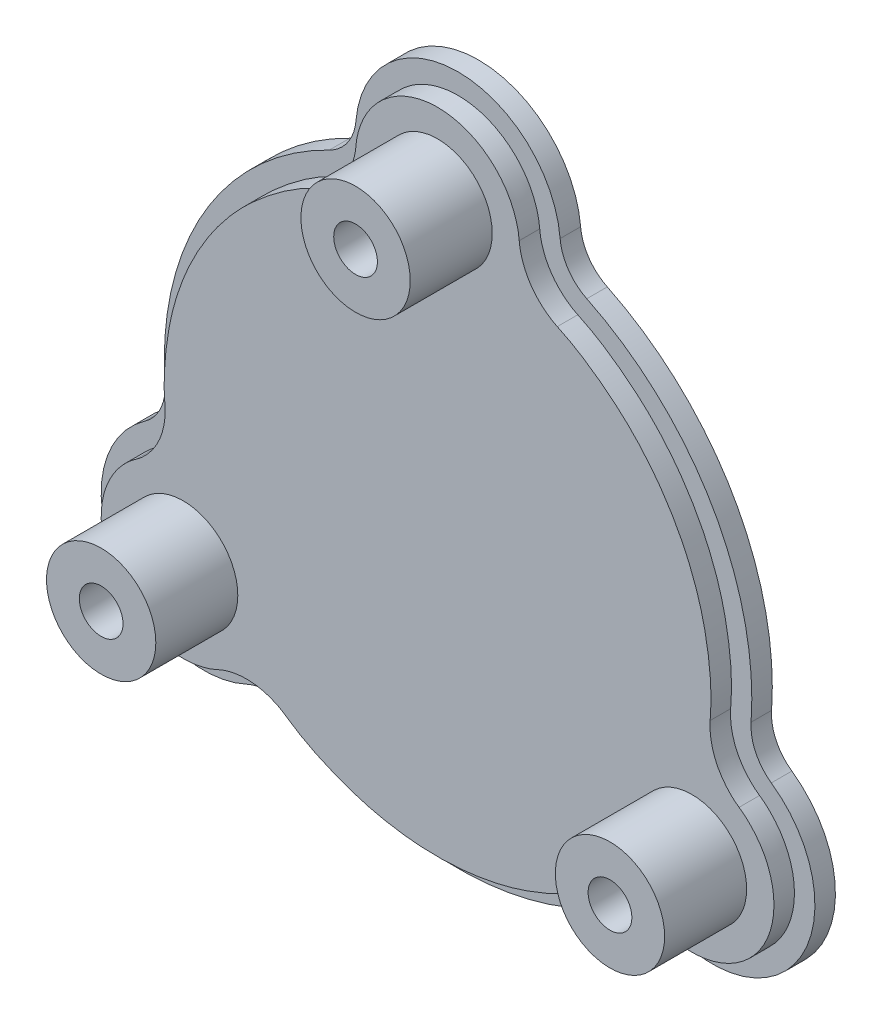
from build123d import *

# Parameters (mm, degrees)
BOSS_EXTRUDE1_DEPTH                     = 3
BOSS_EXTRUDE2_DEPTH                     = 3
SKETCH4_R                               = 8
BOSS_EXTRUDE3_DEPTH                     = 12
CBORE_FOR_M6_HEX_HEAD_BOLT2_D           = 6.4
CBORE_FOR_M6_HEX_HEAD_BOLT2_CBORE_D     = 14.55
CBORE_FOR_M6_HEX_HEAD_BOLT2_CBORE_DEPTH = 4.38


with BuildPart() as part:
    # Sketch1 → Boss-Extrude1 (new body)
    with BuildSketch(Plane.XY):
        with BuildLine():
            ThreePointArc((42.894958583, -3.003752345), (37.239092363, 21.5), (18.846153454, 38.65))
            ThreePointArc((18.846153454, 38.65), (16.147655157, 40.973517523), (14.941453584, 44.323995772))
            ThreePointArc((14.941453584, 44.323995772), (0, 58), (-14.941453584, 44.323995772))
            ThreePointArc((-14.941453584, 44.323995772), (-16.147655157, 40.973517523), (-18.846153454, 38.65))
            ThreePointArc((-18.846153454, 38.65), (-37.239092363, 21.5), (-42.894958583, -3.003752345))
            ThreePointArc((-42.894958583, -3.003752345), (-43.557934635, -6.502479184), (-45.856433127, -9.222319513))
            ThreePointArc((-45.856433127, -9.222319513), (-50.229473419, -29), (-30.914979544, -35.101676259))
            ThreePointArc((-30.914979544, -35.101676259), (-27.410279478, -34.471038339), (-24.048805129, -35.646247655))
            ThreePointArc((-24.048805129, -35.646247655), (0, -43), (24.048805129, -35.646247655))
            ThreePointArc((24.048805129, -35.646247655), (27.410279478, -34.471038339), (30.914979544, -35.101676259))
            ThreePointArc((30.914979544, -35.101676259), (50.229473419, -29), (45.856433127, -9.222319513))
            ThreePointArc((45.856433127, -9.222319513), (43.557934635, -6.502479184), (42.894958583, -3.003752345))
        make_face()
    extrude(amount=BOSS_EXTRUDE1_DEPTH)

    # 3DSketch1 → Boss-Extrude2 (add)
    with BuildSketch(Plane(origin=(17.52698283, 35.955596171, 3), x_dir=(-0.6916901144369885, -0.7221944236769943, 0), z_dir=(0, 0, 1))):
        with BuildLine():
            add(Edge.make_bspline(
                [(-5e-09, -2e-09), (0.035266361, -0.110043051), (0.070511726, -0.220092408), (0.104895107, -0.330400636), (0.203480375, -0.66470447), (0.278915236, -1.005960833), (0.320630187, -1.236304934), (0.40721379, -1.815458075), (0.459739267, -2.397249901), (0.477689586, -2.746840897), (0.483852206, -3.44618664), (0.425322622, -4.144123782), (0.38040418, -4.491793187), (0.260298804, -5.182639628), (0.081734048, -5.860713269), (-0.022258615, -6.195483331), (-0.255051995, -6.841022944), (-0.545064383, -7.461933899), (-0.699515738, -7.760205855), (-0.973198354, -8.243799634), (-1.27383881, -8.712312975), (-1.397769789, -8.893729969), (-1.588782564, -9.152885267), (-1.795468246, -9.399066163), (-1.862478067, -9.476728094), (-1.930013019, -9.553946514), (-1.997546942, -9.631165804), (-1.997678956, -9.63131675)],
                knots=[0, 0, 0, 0, 0, 0, 0.056254645, 0.056254645, 0.056254645, 0.16970042, 0.16970042, 0.16970042, 0.339869082, 0.339869082, 0.339869082, 0.510037744, 0.510037744, 0.510037744, 0.680206406, 0.680206406, 0.680206406, 0.843494618, 0.843494618, 0.843494618, 0.950059942, 0.950059942, 0.950059942, 0.999902378, 1, 1, 1, 1, 1, 1], degree=5))
            add(Edge.make_bspline(
                [(-1.997678956, -9.63131675), (-2.08959454, -9.736414413), (-2.181506582, -9.841515062), (-2.272592776, -9.947311862), (-2.541163817, -10.269178096), (-2.787458164, -10.609822544), (-2.943189419, -10.843616244), (-3.314575566, -11.440159763), (-3.649648712, -12.05581974), (-3.836008647, -12.432252484), (-4.176138071, -13.199501153), (-4.444641518, -13.996135515), (-4.560994108, -14.400468331), (-4.757915743, -15.218503654), (-4.88329973, -16.049955203), (-4.92791192, -16.468048122), (-4.980585913, -17.30699442), (-4.959377566, -18.147513988), (-4.930398613, -18.567074878), (-4.835882755, -19.402614449), (-4.668634216, -20.226620759), (-4.567080093, -20.63470489), (-4.328618776, -21.440963688), (-4.020464586, -22.223260728), (-3.849402412, -22.607436813), (-3.474184186, -23.359880124), (-3.03453076, -24.076577736), (-2.799195391, -24.425101105), (-2.298707632, -25.100718946), (-1.740986405, -25.729922945), (-1.448563927, -26.032149947), (-0.838088247, -26.610310881), (-0.179337131, -27.132799529), (0.161238539, -27.379496673), (0.86305261, -27.842538384), (1.602717154, -28.242358509), (1.981045035, -28.425992834), (2.752757991, -28.759769331), (3.550717298, -29.024680158), (3.955231721, -29.139632075), (4.773276467, -29.333954761), (5.60524574, -29.455966835), (6.02362314, -29.498762544), (6.862986736, -29.547667959), (7.703214448, -29.522670666), (8.122551174, -29.491862507), (8.957684048, -29.393959495), (9.781763129, -29.224147752), (10.189710671, -29.121200722), (10.986985231, -28.881435911), (11.757782621, -28.570392467), (12.133021443, -28.40048319), (12.74548272, -28.094617193), (13.340811758, -27.753563617), (13.573244441, -27.611033126), (13.909717951, -27.387077196), (14.229785182, -27.141883629), (14.333162523, -27.060284984), (14.43595641, -26.977931068), (14.538750297, -26.895577152)],
                knots=[0, 0, 0, 0, 0, 0, 0.019647282, 0.019647282, 0.019647282, 0.058998284, 0.058998284, 0.058998284, 0.118024786, 0.118024786, 0.118024786, 0.177051289, 0.177051289, 0.177051289, 0.236077791, 0.236077791, 0.236077791, 0.295104294, 0.295104294, 0.295104294, 0.354130796, 0.354130796, 0.354130796, 0.413157299, 0.413157299, 0.413157299, 0.472183801, 0.472183801, 0.472183801, 0.531210303, 0.531210303, 0.531210303, 0.590236806, 0.590236806, 0.590236806, 0.649263308, 0.649263308, 0.649263308, 0.708289811, 0.708289811, 0.708289811, 0.767316313, 0.767316313, 0.767316313, 0.826342816, 0.826342816, 0.826342816, 0.885369318, 0.885369318, 0.885369318, 0.943255046, 0.943255046, 0.943255046, 0.981465274, 0.981465274, 0.981465274, 1, 1, 1, 1, 1, 1], degree=5))
            add(Edge.make_bspline(
                [(14.538750297, -26.895577152), (14.629684163, -26.82272496), (14.720618029, -26.749872769), (14.812101728, -26.677733351), (15.08985182, -26.46559174), (15.382447395, -26.272695025), (15.58269011, -26.151445708), (16.09269691, -25.863681663), (16.61733503, -25.606785774), (16.93744564, -25.465133821), (17.588443263, -25.20954716), (18.261235543, -25.014887162), (18.602010271, -24.932642007), (19.290176753, -24.798027742), (19.987296982, -24.722578281), (20.337126908, -24.700117406), (21.023232236, -24.68694056), (21.706774662, -24.736005316), (22.040540429, -24.773711992), (22.589993047, -24.856578987), (23.134990596, -24.970012256), (23.348709182, -25.020957123), (23.659000434, -25.106786531), (23.962582833, -25.211824015), (24.058871197, -25.246596685), (24.154932466, -25.282019553), (24.250993734, -25.31744242)],
                knots=[0, 0, 0, 0, 0, 0, 0.056701872, 0.056701872, 0.056701872, 0.170105617, 0.170105617, 0.170105617, 0.340211235, 0.340211235, 0.340211235, 0.510316852, 0.510316852, 0.510316852, 0.68042247, 0.68042247, 0.68042247, 0.843650186, 0.843650186, 0.843650186, 0.950176029, 0.950176029, 0.950176029, 1, 1, 1, 1, 1, 1], degree=5))
            add(Edge.make_bspline(
                [(24.250993734, -25.31744242), (24.688281546, -25.478693551), (25.125569359, -25.639944681), (25.564041321, -25.797795795), (26.886562113, -26.250949036), (28.24105497, -26.612301824), (29.154388981, -26.818757641), (31.453893364, -27.264667471), (33.769627175, -27.574716515), (35.163496873, -27.706655842), (37.957268727, -27.851993868), (40.757452768, -27.739529771), (42.15492964, -27.620381007), (44.9362167, -27.259317677), (47.673297615, -26.658858001), (49.027792613, -26.299620421), (51.702703848, -25.464812466), (54.297481866, -24.400704296), (55.570389357, -23.811899917), (57.968514361, -22.568515579), (60.242594713, -21.118498443), (61.309447209, -20.377460408), (63.016442498, -19.098431895), (64.655265574, -17.728305153), (65.280100369, -17.176291521), (66.15076627, -16.352968306), (66.97038033, -15.481790697), (67.217355778, -15.212936235), (67.462746124, -14.942595948), (67.70813647, -14.672255661)],
                knots=[0, 0, 0, 0, 0, 0, 0.049139834, 0.049139834, 0.049139834, 0.147419501, 0.147419501, 0.147419501, 0.294839003, 0.294839003, 0.294839003, 0.442258504, 0.442258504, 0.442258504, 0.589678005, 0.589678005, 0.589678005, 0.737097507, 0.737097507, 0.737097507, 0.873871505, 0.873871505, 0.873871505, 0.961505669, 0.961505669, 0.961505669, 1, 1, 1, 1, 1, 1], degree=5))
            add(Edge.make_bspline(
                [(67.70813647, -14.672255661), (67.786449566, -14.58598012), (67.864762661, -14.49970458), (67.943731072, -14.41404623), (68.184568195, -14.160774327), (68.443098826, -13.92416658), (68.621725194, -13.772868323), (69.079994725, -13.408308152), (69.557578488, -13.071923842), (69.851358012, -12.881582911), (70.453927882, -12.526573055), (71.087623969, -12.22829259), (71.411173726, -12.093358399), (72.069516983, -11.851949485), (72.74602836, -11.66755428), (73.087944069, -11.590229537), (73.763394463, -11.469064712), (74.446125317, -11.40976733), (74.781662086, -11.394390149), (75.337307892, -11.389609358), (75.893372576, -11.415714959), (76.112449791, -11.432333838), (76.432391249, -11.468178104), (76.748735554, -11.524047837), (76.849301415, -11.543207566), (76.949745513, -11.563045161), (77.05018961, -11.582882756)],
                knots=[0, 0, 0, 0, 0, 0, 0.056701872, 0.056701872, 0.056701872, 0.170105617, 0.170105617, 0.170105617, 0.340211235, 0.340211235, 0.340211235, 0.510316852, 0.510316852, 0.510316852, 0.68042247, 0.68042247, 0.68042247, 0.843650186, 0.843650186, 0.843650186, 0.950176029, 0.950176029, 0.950176029, 1, 1, 1, 1, 1, 1], degree=5))
            add(Edge.make_bspline(
                [(77.05018961, -11.582882756), (77.187361376, -11.609974023), (77.324533142, -11.63706529), (77.46189487, -11.663093271), (77.875119824, -11.734797495), (78.293473743, -11.777792987), (78.573810653, -11.79576336), (79.27612557, -11.819121438), (79.976839322, -11.801473306), (80.396019609, -11.774649372), (81.230541159, -11.68558576), (82.054698478, -11.519799385), (82.463037263, -11.418397276), (83.269937451, -11.179918753), (84.052687609, -10.872778695), (84.437072793, -10.702367526), (85.189958595, -10.328511393), (85.90726572, -9.889884642), (86.256126633, -9.655007687), (86.932467199, -9.155384768), (87.562453326, -8.598540129), (87.865087489, -8.306549613), (88.444097432, -7.696906655), (88.967509446, -7.038888779), (89.214684609, -6.698656548), (89.678710518, -5.997486377), (90.079562144, -5.258386535), (90.263724551, -4.880318443), (90.598582885, -4.109074409), (90.864628918, -3.311471658), (90.98015394, -2.907112863), (91.175618157, -2.089344949), (91.298731041, -1.257605424), (91.3420892, -0.83930967), (91.392188049, 0), (91.368610162, 0.840478348), (91.338478213, 1.259937066), (91.24168066, 2.09514834), (91.072120512, 2.918656784), (90.969414582, 3.326452509), (90.728680591, 4.132061383), (90.41836151, 4.913573946), (90.246234982, 5.297297258), (89.868906515, 6.048660161), (89.427144369, 6.763820059), (89.190795358, 7.111572237), (88.688442425, 7.785867016), (88.129341601, 8.414634563), (87.836213087, 8.716453983), (87.22993339, 9.2870316), (86.57516317, 9.799039999), (86.240398009, 10.039051712), (85.669279647, 10.416525739), (85.076254067, 10.761569021), (84.8366027, 10.891596385), (84.47441442, 11.071013026), (84.102036946, 11.225602596), (83.979681776, 11.274330677), (83.85696425, 11.322175836), (83.734246723, 11.370020996)],
                knots=[0, 0, 0, 0, 0, 0, 0.019674946, 0.019674946, 0.019674946, 0.059024837, 0.059024837, 0.059024837, 0.118049674, 0.118049674, 0.118049674, 0.177074511, 0.177074511, 0.177074511, 0.236099347, 0.236099347, 0.236099347, 0.295124184, 0.295124184, 0.295124184, 0.354149021, 0.354149021, 0.354149021, 0.413173858, 0.413173858, 0.413173858, 0.472198695, 0.472198695, 0.472198695, 0.531223532, 0.531223532, 0.531223532, 0.590248368, 0.590248368, 0.590248368, 0.649273205, 0.649273205, 0.649273205, 0.708298042, 0.708298042, 0.708298042, 0.767322879, 0.767322879, 0.767322879, 0.826347716, 0.826347716, 0.826347716, 0.885372553, 0.885372553, 0.885372553, 0.943256647, 0.943256647, 0.943256647, 0.981465797, 0.981465797, 0.981465797, 1, 1, 1, 1, 1, 1], degree=5))
            add(Edge.make_bspline(
                [(83.734246723, 11.370020996), (83.625687941, 11.412345938), (83.517129159, 11.45467088), (83.408912741, 11.497828378), (83.086317671, 11.632296209), (82.772966428, 11.789243053), (82.567840082, 11.902033672), (82.063625708, 12.199830494), (81.578828283, 12.52573249), (81.296098788, 12.732130434), (80.749255435, 13.168117582), (80.244278791, 13.653442789), (80.002665034, 13.907439783), (79.54200242, 14.436102306), (79.128101155, 15.002101403), (78.933734504, 15.293832568), (78.579270356, 15.881428789), (78.279990469, 16.497926273), (78.145762524, 16.805829244), (77.942801139, 17.323102667), (77.768538457, 17.851801024), (77.705798713, 18.062359182), (77.624983535, 18.373993993), (77.564157464, 18.689422804), (77.545987906, 18.790976402), (77.528505445, 18.892660413), (77.511017753, 18.994343431), (77.510883592, 18.995123517), (77.510749431, 18.995903603)],
                knots=[0, 0, 0, 0, 0, 0, 0.05668004, 0.05668004, 0.05668004, 0.170040119, 0.170040119, 0.170040119, 0.340080239, 0.340080239, 0.340080239, 0.510120358, 0.510120358, 0.510120358, 0.680160478, 0.680160478, 0.680160478, 0.843325344, 0.843325344, 0.843325344, 0.94981017, 0.94981017, 0.94981017, 0.999614957, 0.999614957, 1, 1, 1, 1, 1, 1], degree=5))
            add(Edge.make_bspline(
                [(77.510749431, 18.995903603), (77.4318872, 19.454451425), (77.353007011, 19.912995822), (77.270590277, 20.370865721), (77.001870254, 21.741991991), (76.637770756, 23.094927269), (76.359899732, 23.989125633), (75.596316782, 26.20350976), (74.706960225, 28.36401859), (74.124288185, 29.637114822), (72.85326868, 32.129261233), (71.355779895, 34.498059699), (70.553855602, 35.64873579), (68.850522056, 37.876869374), (66.961968265, 39.947021141), (65.973611896, 40.940429429), (63.913191382, 42.839566533), (61.694257666, 44.554656129), (60.54788437, 45.362624163), (58.272019445, 46.817769169), (55.879227593, 48.062171956), (54.704043582, 48.615574302), (52.742874753, 49.45436133), (50.73689865, 50.188560375), (49.946423423, 50.453676365), (48.798071653, 50.796033545), (47.633802683, 51.070251339), (47.277480165, 51.14971112), (46.920663436, 51.22705525), (46.563846706, 51.30439938)],
                knots=[0, 0, 0, 0, 0, 0, 0.049060473, 0.049060473, 0.049060473, 0.147348343, 0.147348343, 0.147348343, 0.294780148, 0.294780148, 0.294780148, 0.442211954, 0.442211954, 0.442211954, 0.589643759, 0.589643759, 0.589643759, 0.737075564, 0.737075564, 0.737075564, 0.873860978, 0.873860978, 0.873860978, 0.961502456, 0.961502456, 0.961502456, 1, 1, 1, 1, 1, 1], degree=5))
            add(Edge.make_bspline(
                [(46.563846706, 51.30439938), (46.449973349, 51.32908274), (46.336099991, 51.3537661), (46.222433479, 51.379325575), (45.882675015, 51.46126069), (45.54850138, 51.566850911), (45.328160062, 51.645896754), (44.783306927, 51.860489725), (44.253197687, 52.10589724), (43.941467844, 52.265147306), (43.332735355, 52.609483193), (42.757568852, 53.009139871), (42.478937536, 53.221875084), (41.940699656, 53.671312612), (41.442753035, 54.164991047), (41.204829989, 54.422436366), (40.762172975, 54.946811154), (40.369454508, 55.508424726), (40.188369095, 55.791319501), (39.906405905, 56.270132489), (39.650981677, 56.764751432), (39.555835441, 56.962787306), (39.426906757, 57.25778687), (39.317038642, 57.559905494), (39.283275418, 57.656802194), (39.250158625, 57.753931835), (39.217040343, 57.85106094), (39.216964249, 57.851284107)],
                knots=[0, 0, 0, 0, 0, 0, 0.056695367, 0.056695367, 0.056695367, 0.170086102, 0.170086102, 0.170086102, 0.340172203, 0.340172203, 0.340172203, 0.510258305, 0.510258305, 0.510258305, 0.680344407, 0.680344407, 0.680344407, 0.843553396, 0.843553396, 0.843553396, 0.950067017, 0.950067017, 0.950067017, 0.999885272, 1, 1, 1, 1, 1, 1], degree=5))
            add(Edge.make_bspline(
                [(39.216964249, 57.851284107), (39.171916168, 57.983400801), (39.126862966, 58.115515644), (39.080793958, 58.247263359), (38.936344985, 58.640751899), (38.764499864, 59.024339029), (38.639894208, 59.276103101), (38.308965439, 59.896004699), (37.943324832, 60.494016544), (37.71050448, 60.843625354), (37.216112354, 61.52181041), (36.660458483, 62.152658398), (36.368472288, 62.455589104), (35.758493734, 63.035145904), (35.101127564, 63.559457397), (34.76135457, 63.807139146), (34.06114276, 64.272229311), (33.322627288, 64.674122128), (32.944787422, 64.858806063), (32.173930999, 65.194722715), (31.376696332, 65.461884385), (30.972508047, 65.577978001), (30.155036786, 65.774593842), (29.323470582, 65.898873005), (28.905233246, 65.942816859), (28.06598911, 65.994089999), (27.225484059, 65.971687769), (26.805986283, 65.942143046), (25.97064019, 65.846516853), (25.146872929, 65.678118101), (24.738925429, 65.575986307), (23.932985532, 65.336379328), (23.151121532, 65.02712845), (22.767187704, 64.85552984), (22.015274783, 64.479261882), (21.299188126, 64.038603658), (20.950992195, 63.802779266), (20.276076791, 63.301344489), (19.647677632, 62.742746871), (19.34586914, 62.449903064), (18.768558384, 61.838616876), (18.246908192, 61.179116387), (18.000657321, 60.838188784), (17.538622192, 60.135731295), (17.140156626, 59.395574105), (16.957168911, 59.017013768), (16.62438897, 58.244815978), (16.359410713, 57.446236687), (16.244591684, 57.041470237), (16.053596822, 56.231127809), (15.937569651, 55.408075966), (15.897095991, 54.998154976), (15.855753076, 54.314814952), (15.853449617, 53.628718094), (15.860668301, 53.35616024), (15.886383072, 52.952787667), (15.938693314, 52.553004531), (15.957671143, 52.422677805), (15.977594783, 52.29247873), (15.997518423, 52.162279654)],
                knots=[0, 0, 0, 0, 0, 0, 0.019642419, 0.019642419, 0.019642419, 0.058993616, 0.058993616, 0.058993616, 0.118020411, 0.118020411, 0.118020411, 0.177047206, 0.177047206, 0.177047206, 0.236074002, 0.236074002, 0.236074002, 0.295100797, 0.295100797, 0.295100797, 0.354127592, 0.354127592, 0.354127592, 0.413154387, 0.413154387, 0.413154387, 0.472181183, 0.472181183, 0.472181183, 0.531207978, 0.531207978, 0.531207978, 0.590234773, 0.590234773, 0.590234773, 0.649261568, 0.649261568, 0.649261568, 0.708288364, 0.708288364, 0.708288364, 0.767315159, 0.767315159, 0.767315159, 0.826341954, 0.826341954, 0.826341954, 0.885368749, 0.885368749, 0.885368749, 0.943254765, 0.943254765, 0.943254765, 0.981465182, 0.981465182, 0.981465182, 1, 1, 1, 1, 1, 1], degree=5))
            add(Edge.make_bspline(
                [(15.997518423, 52.162279654), (16.015143339, 52.04710252), (16.032768254, 51.931925386), (16.049500973, 51.81662847), (16.094345951, 51.470019029), (16.115101619, 51.12017547), (16.11998525, 50.886135534), (16.114192824, 50.300574666), (16.074352129, 49.717776782), (16.036971014, 49.369726885), (15.932816745, 48.678153076), (15.765001108, 47.998167871), (15.665840138, 47.661925721), (15.43833627, 46.998648934), (15.155117305, 46.357200375), (14.999654031, 46.043008335), (14.66801285, 45.442235268), (14.283750311, 44.874802541), (14.084212489, 44.604606245), (13.737721257, 44.170199819), (13.36698639, 43.75493473), (13.216007548, 43.595321439), (12.986531474, 43.369516037), (12.743775146, 43.159124708), (12.664888145, 43.092592552), (12.585544382, 43.026590549), (12.506204231, 42.960584354), (12.505571818, 42.960058224), (12.504939404, 42.959532094)],
                knots=[0, 0, 0, 0, 0, 0, 0.056679182, 0.056679182, 0.056679182, 0.170037546, 0.170037546, 0.170037546, 0.340075091, 0.340075091, 0.340075091, 0.510112637, 0.510112637, 0.510112637, 0.680150183, 0.680150183, 0.680150183, 0.843312579, 0.843312579, 0.843312579, 0.949795794, 0.949795794, 0.949795794, 0.999599826, 0.999599826, 1, 1, 1, 1, 1, 1], degree=5))
            add(Edge.make_bspline(
                [(12.504939404, 42.959532094), (12.14728038, 42.661981384), (11.789633769, 42.364416293), (11.434339562, 42.064125714), (10.381294253, 41.145863023), (9.391689717, 40.154098053), (8.756226729, 39.466355505), (7.220305297, 37.697881209), (5.793928043, 35.847421423), (4.982730385, 34.706264518), (3.459978035, 32.359456132), (2.15728278, 29.87819357), (1.5617302, 28.608368715), (0.483776687, 26.019171801), (-0.364750438, 23.348560358), (-0.730889067, 21.99591449), (-1.345379787, 19.261969431), (-1.721224089, 16.482771665), (-1.847758285, 15.085999252), (-1.970018363, 12.387469908), (-1.851306864, 9.693049985), (-1.742975348, 8.398609604), (-1.488801808, 6.280794063), (-1.121648781, 4.176468276), (-0.95600835, 3.359338653), (-0.67832248, 2.193658258), (-0.333667571, 1.048262856), (-0.224032432, 0.699030998), (-0.112307024, 0.350432284), (-0.000587094, 0.001831912), (-0.000293547, 0.000915956), (-5e-09, -2e-09)],
                knots=[0, 0, 0, 0, 0, 0, 0.049052378, 0.049052378, 0.049052378, 0.147330603, 0.147330603, 0.147330603, 0.294747941, 0.294747941, 0.294747941, 0.442165279, 0.442165279, 0.442165279, 0.589582617, 0.589582617, 0.589582617, 0.736999955, 0.736999955, 0.736999955, 0.873771946, 0.873771946, 0.873771946, 0.961404824, 0.961404824, 0.961404824, 0.99989859, 0.99989859, 1, 1, 1, 1, 1, 1], degree=5))
        make_face()
    extrude(amount=BOSS_EXTRUDE2_DEPTH)

    # Sketch4 → Boss-Extrude3 (add)
    with BuildSketch(Plane.XY.offset(6)):
        with Locations((0, 43)):
            Circle(SKETCH4_R)
        with Locations((37.239092363, -21.5)):
            Circle(SKETCH4_R)
        with Locations((-37.239092363, -21.5)):
            Circle(SKETCH4_R)
    extrude(amount=BOSS_EXTRUDE3_DEPTH)

    # CBORE for M6 Hex Head Bolt2 (through all)
    with Locations(Plane(origin=(0, 0, 0), x_dir=(-1, 0, 0), z_dir=(0, 0, -1))):
        with Locations((0, 43), (37.239092363, -21.5), (-37.239092363, -21.5)):
            CounterBoreHole(CBORE_FOR_M6_HEX_HEAD_BOLT2_D / 2, CBORE_FOR_M6_HEX_HEAD_BOLT2_CBORE_D / 2, CBORE_FOR_M6_HEX_HEAD_BOLT2_CBORE_DEPTH)


solid = part.part
